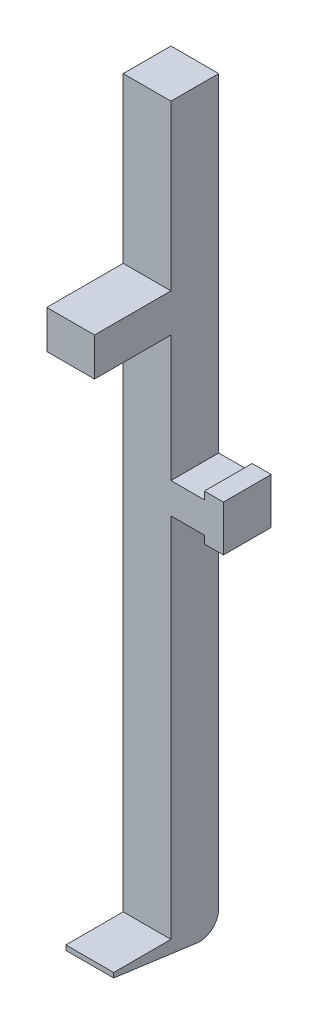
from build123d import *

# Parameters (mm, degrees)
SKETCH2_W           = 2.5
SKETCH2_H           = 2.5
BOSS_EXTRUDE1_DEPTH = 39
SKETCH3_W           = 2.5
SKETCH3_H           = 1
BOSS_EXTRUDE2_DEPTH = 3
CUT_EXTRUDE1_DEPTH  = 2.5
FILLET1_R           = 1
BOSS_EXTRUDE3_DEPTH = 2.5
SKETCH8_W           = 2.5
SKETCH8_H           = 2
BOSS_EXTRUDE4_DEPTH = 4


with BuildPart() as part:
    # Sketch2 → Boss-Extrude1 (new body)
    with BuildSketch(Plane(origin=(0, 0, 0), x_dir=(1, 0, 0), z_dir=(0, 1, 0))):
        Rectangle(SKETCH2_W, SKETCH2_H)
    extrude(amount=BOSS_EXTRUDE1_DEPTH)

    # Sketch3 → Boss-Extrude2 (add)
    with BuildSketch(Plane.XY.offset(1.25)):
        with Locations((0, 0.5)):
            Rectangle(SKETCH3_W, SKETCH3_H)
    extrude(amount=BOSS_EXTRUDE2_DEPTH)

    # Sketch4 → Cut-Extrude1 (cut)
    with BuildSketch(Plane(origin=(1.25, 0, 0), x_dir=(0, 0, -1), z_dir=(1, 0, 0))):
        Polygon((-4.25, 0), (-4.25, 0.75), (1.25, 0), align=None)
    extrude(amount=-CUT_EXTRUDE1_DEPTH, mode=Mode.SUBTRACT)

    # Fillet1
    fillet1_edges = [part.edges().sort_by_distance(p)[0] for p in [
        (0, 0, -1.25),
    ]]
    fillet(fillet1_edges, radius=FILLET1_R)

    # Sketch6 → Boss-Extrude3 (add)
    with BuildSketch(Plane.XY.offset(1.25)):
        Polygon((1.25, 20.2), (1.25, 21.8), (3, 21.8), (3, 22.2), (4, 22.2), (4, 19.8), (3, 19.8), (3, 20.2), align=None)
    extrude(amount=-BOSS_EXTRUDE3_DEPTH)

    # Sketch8 → Boss-Extrude4 (add)
    with BuildSketch(Plane.XY.offset(1.25)):
        with Locations((0, 29.4)):
            Rectangle(SKETCH8_W, SKETCH8_H)
    extrude(amount=BOSS_EXTRUDE4_DEPTH)


solid = part.part
